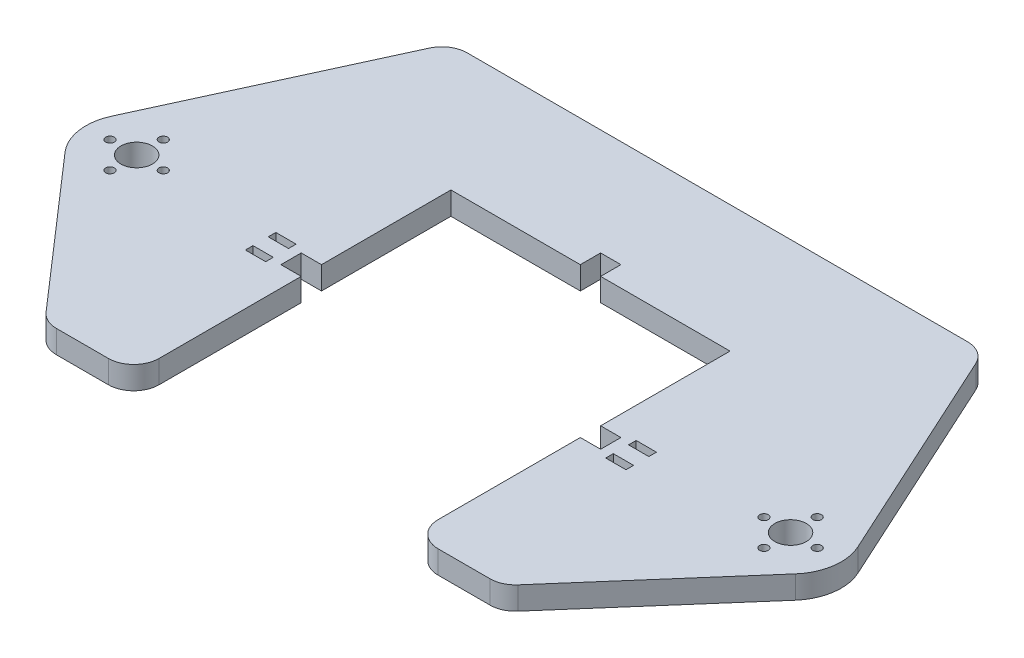
from build123d import *

# Parameters (mm, degrees)
SKETCH_1_W          = 110
SKETCH_1_H          = 110
EXTRUDE_1_DEPTH     = 9
SKETCH_2_R          = 6.2
CUT_EXTRUDE_1_DEPTH = 9
SKETCH_10_W         = 8
SKETCH_10_H         = 8
CUT_EXTRUDE_3_DEPTH = 10
SKETCH_9_W          = 110
SKETCH_9_H          = 15
CUT_EXTRUDE_4_DEPTH = 10
FILLET_1_R          = 10
SKETCH_11_W         = 8
SKETCH_11_H         = 3
CUT_EXTRUDE_5_DEPTH = 10
SKETCH_12_R         = 1.7
CUT_EXTRUDE_6_DEPTH = 10


with BuildPart() as part:
    # 草图1 → 凸台-拉伸1 (new body)
    with BuildSketch(Plane(origin=(0, 0, 0), x_dir=(1, 0, 0), z_dir=(0, 1, 0))):
        with BuildLine():
            Line((-98.584118364, 105), (98.584118364, 105))
            ThreePointArc((98.584118364, 105), (103.984134744, 103.416639656), (107.674116766, 99.167964619))
            Line((107.674116766, 99.167964619), (147.029996803, 13.335929237))
            ThreePointArc((147.029996803, 13.335929237), (148.644315385, 2.139042389), (143.925625878, -8.142507538))
            Line((143.925625878, -8.142507538), (92.989084735, -66.571253769))
            ThreePointArc((92.989084735, -66.571253769), (89.591770698, -69.102541889), (85.451271796, -70))
            Line((85.451271796, -70), (50, -70))
            Line((50, -70), (-55, -70))
            Line((-55, -70), (-85.451271796, -70))
            ThreePointArc((-85.451271796, -70), (-89.591770698, -69.102541889), (-92.989084735, -66.571253769))
            Line((-92.989084735, -66.571253769), (-143.925625878, -8.142507538))
            ThreePointArc((-143.925625878, -8.142507538), (-148.644315385, 2.139042389), (-147.029996803, 13.335929237))
            Line((-147.029996803, 13.335929237), (-107.674116766, 99.167964619))
            ThreePointArc((-107.674116766, 99.167964619), (-103.984134744, 103.416639656), (-98.584118364, 105))
        make_face()
        Rectangle(SKETCH_1_W, SKETCH_1_H, mode=Mode.SUBTRACT)
    extrude(amount=EXTRUDE_1_DEPTH)

    # 草图2 → 切除-拉伸1 (cut)
    with BuildSketch(Plane(origin=(0, 9, 0), x_dir=(1, 0, 0), z_dir=(0, 1, 0))):
        with Locations(Location((-128.85, 5, 0), (0, 0, 270))):
            Circle(SKETCH_2_R)
        with Locations(Location((128.85, 5, 0), (0, 0, 270))):
            Circle(SKETCH_2_R)
    extrude(amount=-CUT_EXTRUDE_1_DEPTH, mode=Mode.SUBTRACT)

    # 草图10 → 切除-拉伸3 (cut)
    with BuildSketch(Plane(origin=(0, 9, 0), x_dir=(1, 0, 0), z_dir=(0, 1, 0))):
        with Locations((-59, 0)):
            Rectangle(SKETCH_10_W, SKETCH_10_H)
        with Locations((0, 59)):
            Rectangle(SKETCH_10_W, SKETCH_10_H)
        with Locations((59, 0)):
            Rectangle(SKETCH_10_W, SKETCH_10_H)
        with Locations((0, -59)):
            Rectangle(SKETCH_10_W, SKETCH_10_H)
    extrude(amount=-CUT_EXTRUDE_3_DEPTH, mode=Mode.SUBTRACT)

    # 草图9 → 切除-拉伸4 (cut)
    with BuildSketch(Plane.XZ):
        with Locations((0, 62.5)):
            Rectangle(SKETCH_9_W, SKETCH_9_H)
    extrude(amount=-CUT_EXTRUDE_4_DEPTH, mode=Mode.SUBTRACT)

    # 圆角1
    fillet_1_edges = [part.edges().sort_by_distance(p)[0] for p in [
        (55, 4.5, 70),
        (-55, 4.5, 70),
    ]]
    fillet(fillet_1_edges, radius=FILLET_1_R)

    # 草图11 → 切除-拉伸5 (cut)
    with BuildSketch(Plane(origin=(0, 9, 0), x_dir=(1, 0, 0), z_dir=(0, 1, 0))):
        with Locations((71, 4.5)):
            Rectangle(SKETCH_11_W, SKETCH_11_H)
        with Locations((71, -4.5)):
            Rectangle(SKETCH_11_W, SKETCH_11_H)
        with Locations((-71, 4.5)):
            Rectangle(SKETCH_11_W, SKETCH_11_H)
        with Locations((-71, -4.5)):
            Rectangle(SKETCH_11_W, SKETCH_11_H)
    extrude(amount=-CUT_EXTRUDE_5_DEPTH, mode=Mode.SUBTRACT)

    # 草图12 → 切除-拉伸6 (cut)
    with BuildSketch(Plane(origin=(0, 9, 0), x_dir=(1, 0, 0), z_dir=(0, 1, 0))):
        with Locations(Location((-128.85, 15.5, 0), (0, 0, 270))):
            Circle(SKETCH_12_R)
        with Locations(Location((-118.35, 5, 0), (0, 0, 270))):
            Circle(SKETCH_12_R)
        with Locations(Location((-128.85, -5.5, 0), (0, 0, 270))):
            Circle(SKETCH_12_R)
        with Locations(Location((-139.35, 5, 0), (0, 0, 270))):
            Circle(SKETCH_12_R)
        with Locations(Location((139.35, 5, 0), (0, 0, 270))):
            Circle(SKETCH_12_R)
        with Locations(Location((128.85, -5.5, 0), (0, 0, 270))):
            Circle(SKETCH_12_R)
        with Locations(Location((118.35, 5, 0), (0, 0, 270))):
            Circle(SKETCH_12_R)
        with Locations(Location((128.85, 15.5, 0), (0, 0, 270))):
            Circle(SKETCH_12_R)
    extrude(amount=-CUT_EXTRUDE_6_DEPTH, mode=Mode.SUBTRACT)


solid = part.part
